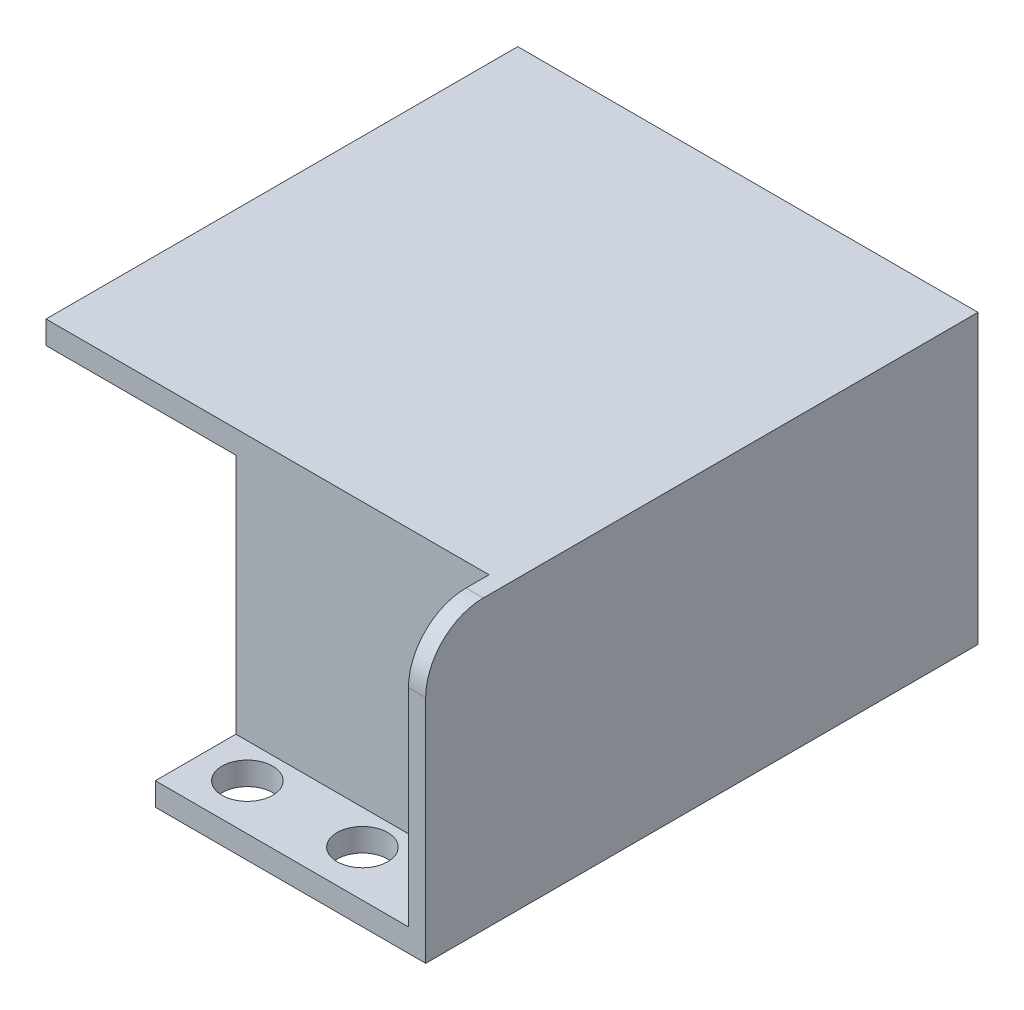
from build123d import *

# Parameters (mm, degrees)
BOSS_EXTRUDE1_DEPTH = 22
SKETCH4_W           = 48
SKETCH4_H           = 25
BOSS_EXTRUDE3_DEPTH = 1.5
SKETCH5_W           = 40
SKETCH5_H           = 41
BOSS_EXTRUDE4_DEPTH = 2
CUT_EXTRUDE2_REACH  = 54.7
SKETCH6_R           = 2.2
LPATTERN2_COUNT     = 2
LPATTERN2_PITCH     = 10
FILLET2_R           = 5


with BuildPart() as part:
    # Sketch1 → Boss-Extrude1 (new body)
    with BuildSketch(Plane(origin=(0, 0, 0), x_dir=(0, 0, -1), z_dir=(1, 0, 0))):
        Polygon((-8, -25), (0, -25), (0, 0), (-1, 0), (-1, -23), (-8, -23), align=None)
    extrude(amount=BOSS_EXTRUDE1_DEPTH)

    # Sketch4 → Boss-Extrude3 (add)
    with BuildSketch(Plane(origin=(22, 0, 0), x_dir=(0, 0, -1), z_dir=(1, 0, 0))):
        with Locations((16, -12.5)):
            Rectangle(SKETCH4_W, SKETCH4_H)
    extrude(amount=BOSS_EXTRUDE3_DEPTH)

    # Sketch5 → Boss-Extrude4 (add)
    with BuildSketch(Plane(origin=(0, 0, 0), x_dir=(1, 0, 0), z_dir=(0, 1, 0))):
        with Locations((3.5, 19.5)):
            Rectangle(SKETCH5_W, SKETCH5_H)
    extrude(amount=-BOSS_EXTRUDE4_DEPTH)

    # Sketch6 → Cut-Extrude2 (cut, up to next)
    with BuildSketch(Plane.XZ.offset(25), mode=Mode.PRIVATE) as cut_extrude2_sk1:
        with Locations(Location((14, 4, 0), (0, 0, 270))):
            Circle(SKETCH6_R)
    cut_extrude2_tool1 = extrude(cut_extrude2_sk1.sketch, amount=-CUT_EXTRUDE2_REACH, mode=Mode.PRIVATE) & part.part
    cut_extrude2 = cut_extrude2_tool1.solids().sort_by_distance((14, -25, 4))[0]
    add(cut_extrude2, mode=Mode.SUBTRACT)

    # LPattern2: Cut-Extrude2 ×2
    with Locations(*[(-i * LPATTERN2_PITCH, 0, 0) for i in range(1, LPATTERN2_COUNT)]):
        add(cut_extrude2, mode=Mode.SUBTRACT)

    # Fillet2
    fillet2_edges = [part.edges().sort_by_distance(p)[0] for p in [
        (22.75, 0, 8),
    ]]
    fillet(fillet2_edges, radius=FILLET2_R)


solid = part.part
